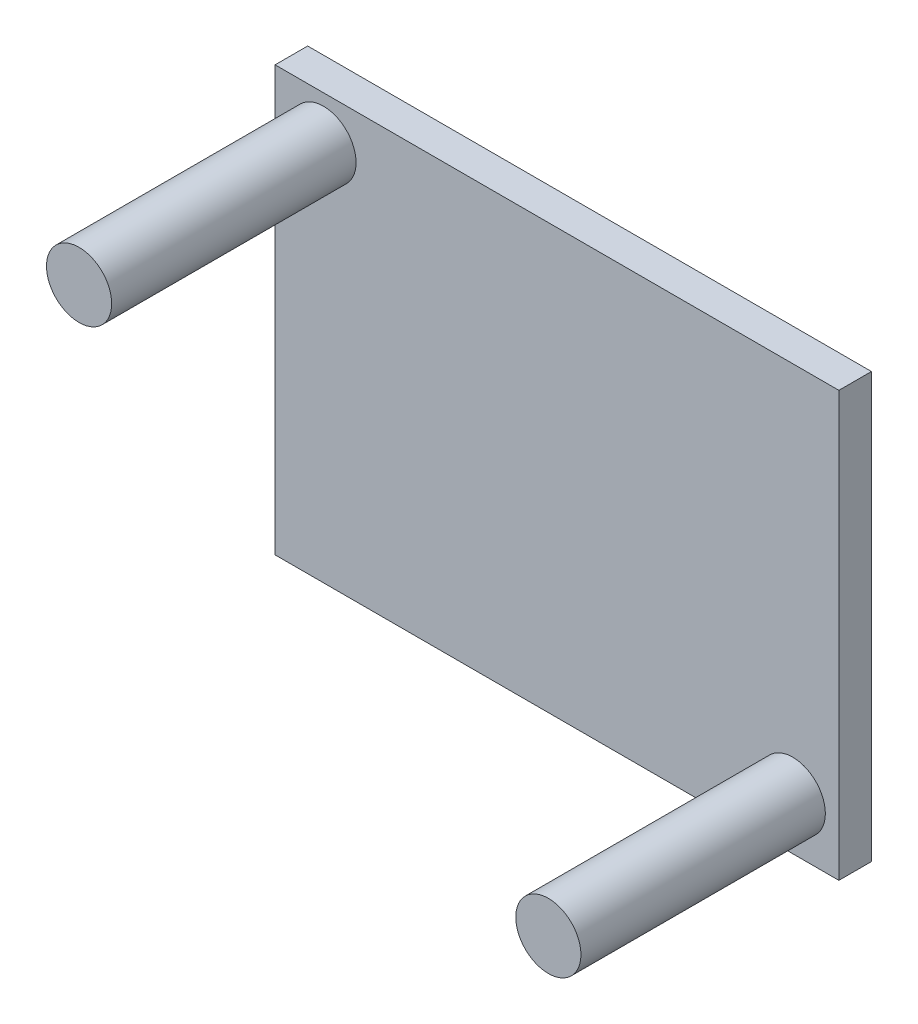
from build123d import *

# Parameters (mm, degrees)
SKETCH1_R             = 2
BOSS_EXTRUDE1_DEPTH   = 15
BOSS_EXTRUDE1_2_DEPTH = 15
SKETCH2_W             = 34.599574116
SKETCH2_H             = 26.046082642
BOSS_EXTRUDE2_DEPTH   = 2


with BuildPart() as part:
    # Sketch1 → Boss-Extrude1 (new body)
    with BuildSketch(Plane.XY):
        Circle(SKETCH1_R)
    extrude(amount=BOSS_EXTRUDE1_DEPTH)



with BuildPart() as body_2:
    # Sketch1 → Boss-Extrude1 2 (new body)
    with BuildSketch(Plane.XY):
        with Locations((28.8, -20.2)):
            Circle(SKETCH1_R)
    extrude(amount=BOSS_EXTRUDE1_2_DEPTH)


with BuildPart() as part_1:
    add(part.part)

    add(body_2.part)  # Boss-Extrude2 merges body 2
    # Sketch2 → Boss-Extrude2 (add)
    with BuildSketch(Plane.XY):
        with Locations((14.329889414, -10.310331758)):
            Rectangle(SKETCH2_W, SKETCH2_H)
    extrude(amount=-BOSS_EXTRUDE2_DEPTH)


solid = part_1.part
